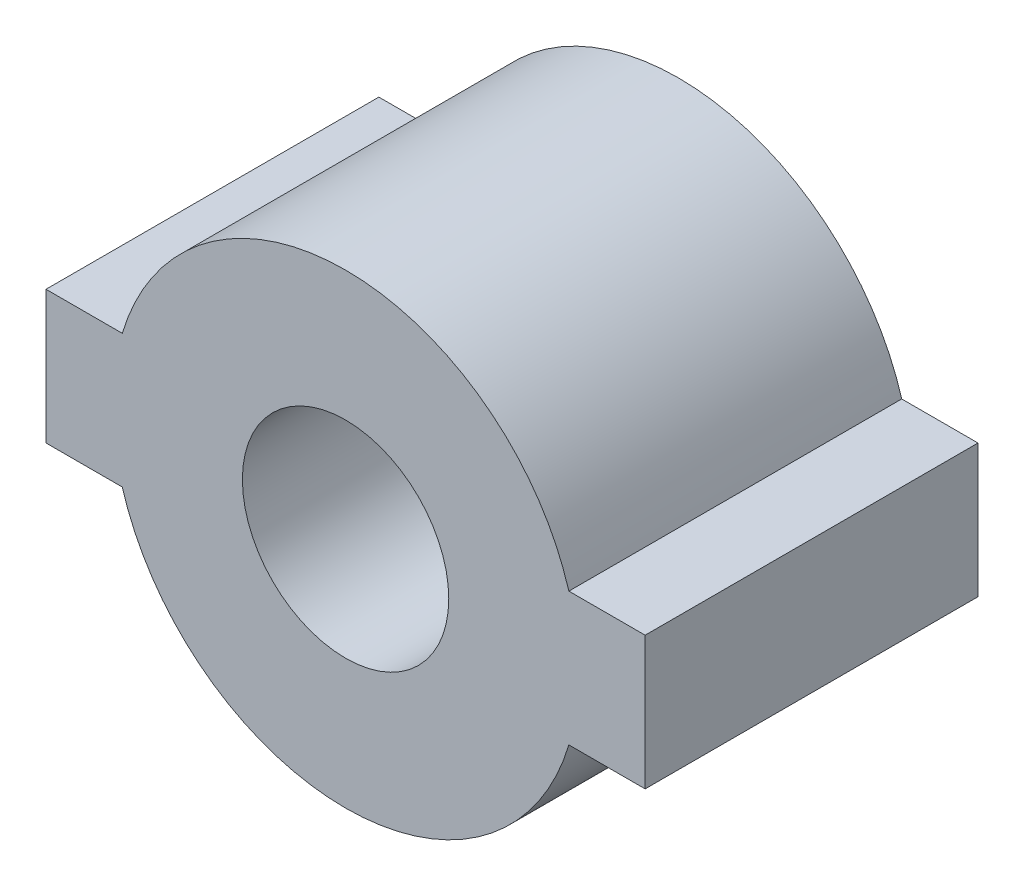
from build123d import *

# Parameters (mm, degrees)
SKETCH_1_R      = 1.55
EXTRUDE_1_DEPTH = 5


with BuildPart() as part:
    # 草圖1 → 填料-伸長1 (new body)
    with BuildSketch(Plane.XY):
        with BuildLine():
            Line((-4.5, 1), (-3.354101966, 1))
            ThreePointArc((-3.354101966, 1), (0, 3.5), (3.354101966, 1))
            Line((3.354101966, 1), (4.5, 1))
            Line((4.5, 1), (4.5, -1))
            Line((4.5, -1), (3.354101966, -1))
            ThreePointArc((3.354101966, -1), (0, -3.5), (-3.354101966, -1))
            Line((-3.354101966, -1), (-4.5, -1))
            Line((-4.5, -1), (-4.5, 1))
        make_face()
        Circle(SKETCH_1_R, mode=Mode.SUBTRACT)
    extrude(amount=EXTRUDE_1_DEPTH)


solid = part.part
